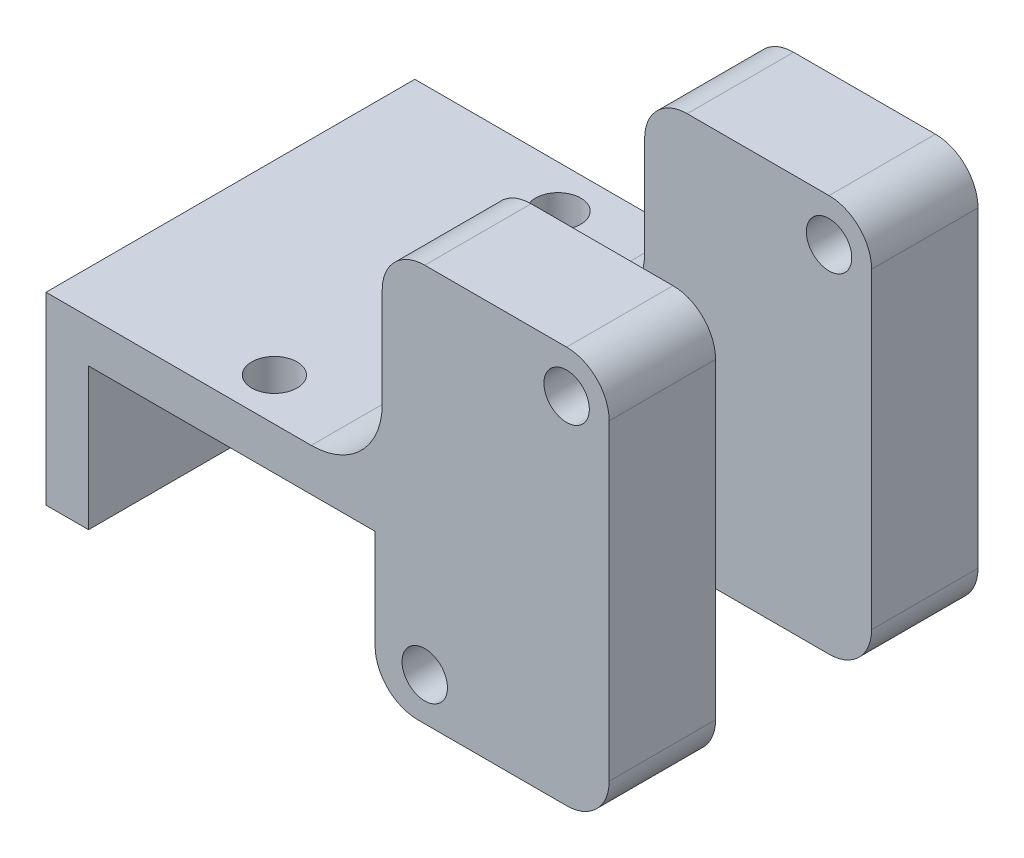
from build123d import *

# Parameters (mm, degrees)
SKETCH_1_R          = 1.6
EXTRUDE_1_DEPTH     = 13
SKETCH_2_W          = 16.5
SKETCH_2_H          = 11
CUT_EXTRUDE_1_DEPTH = 41.749969325
SKETCH_3_R          = 1.6
CUT_EXTRUDE_2_DEPTH = 34.189757456
FILLET_2_R          = 5
FILLET_3_R          = 3


with BuildPart() as part:
    # 草图1 → 凸台-拉伸1 (new, symmetric)
    with BuildSketch(Plane.XY):
        Polygon((-10.1, 0), (-10.1, 10), (10.1, 10), (10.1, 0), (13.1, 0), (26.6, 0), (26.6, 28), (10.6, 28), (10.6, 13), (-13.1, 13), (-13.1, 0), align=None)
        with Locations(Location((23.6, 25, 0), (0, 0, 180))):
            Circle(SKETCH_1_R, mode=Mode.SUBTRACT)
        with Locations(Location((13.6, 3, 0), (0, 0, 180))):
            Circle(SKETCH_1_R, mode=Mode.SUBTRACT)
    extrude(amount=EXTRUDE_1_DEPTH, both=True)

    # 草图2 → 切除-拉伸1 (cut, through all)
    with BuildSketch(Plane.XZ):
        with Locations((18.35, 0)):
            Rectangle(SKETCH_2_W, SKETCH_2_H)
    extrude(amount=-CUT_EXTRUDE_1_DEPTH, mode=Mode.SUBTRACT)

    # 草图3 → 切除-拉伸2 (cut, through all)
    with BuildSketch(Plane(origin=(0, 13, 0), x_dir=(1, 0, 0), z_dir=(0, 1, 0))):
        with Locations(Location((0, 10, 0), (0, 0, 180))):
            Circle(SKETCH_3_R)
        with Locations(Location((0, -10, 0), (0, 0, 180))):
            Circle(SKETCH_3_R)
    extrude(amount=-CUT_EXTRUDE_2_DEPTH, mode=Mode.SUBTRACT)

    # 圆角2
    fillet_2_edges = [part.edges().sort_by_distance(p)[0] for p in [
        (10.6, 13, -9.25),
    ]]
    fillet(fillet_2_edges, radius=FILLET_2_R)

    # 圆角3
    fillet_3_edges = [part.edges().sort_by_distance(p)[0] for p in [
        (10.6, 28, 9.25),
        (26.6, 28, 9.25),
        (26.6, 0, 9.25),
        (10.1, 0, 9.25),
        (10.6, 28, -9.25),
        (26.6, 28, -9.25),
        (26.6, 0, -9.25),
        (10.1, 0, -9.25),
    ]]
    fillet(fillet_3_edges, radius=FILLET_3_R)


solid = part.part
